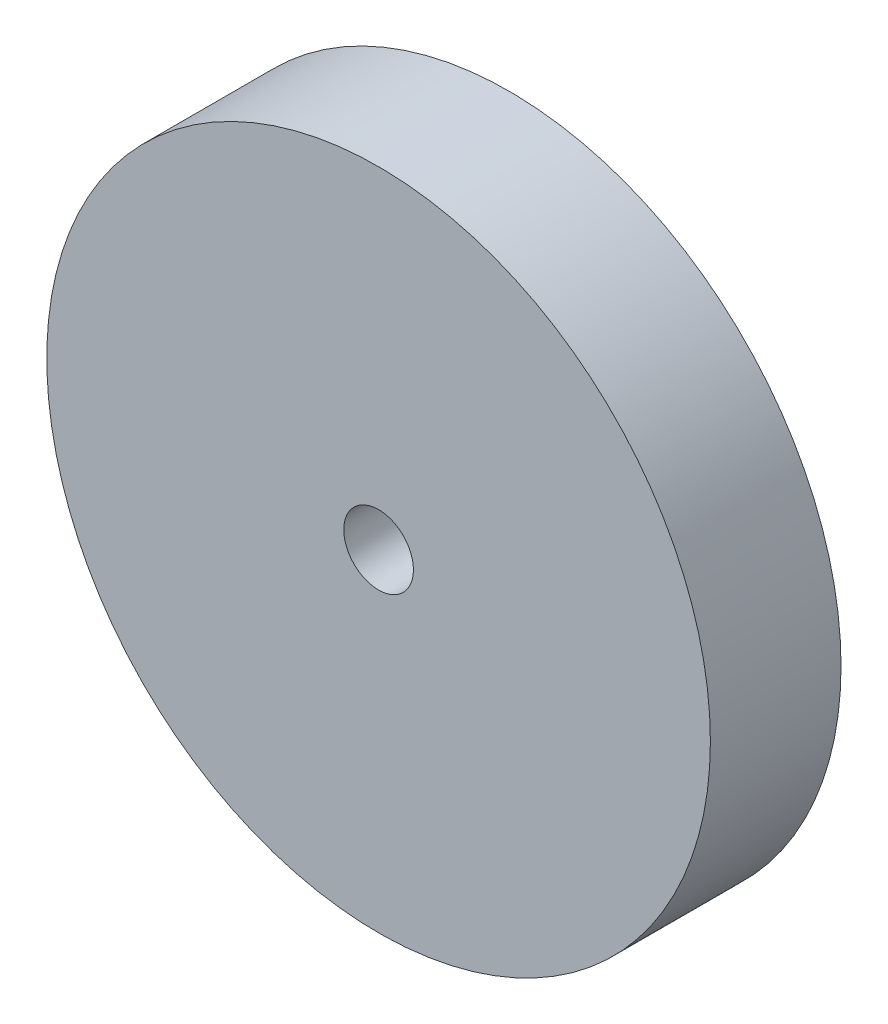
from build123d import *

# Parameters (mm, degrees)
SKETCH1_R           = 38.1
SKETCH1_R_2         = 4
BOSS_EXTRUDE1_DEPTH = 15


with BuildPart() as part:
    # Sketch1 → Boss-Extrude1 (new body)
    with BuildSketch(Plane.XY):
        Circle(SKETCH1_R)
        Circle(SKETCH1_R_2, mode=Mode.SUBTRACT)
    extrude(amount=BOSS_EXTRUDE1_DEPTH)


solid = part.part
